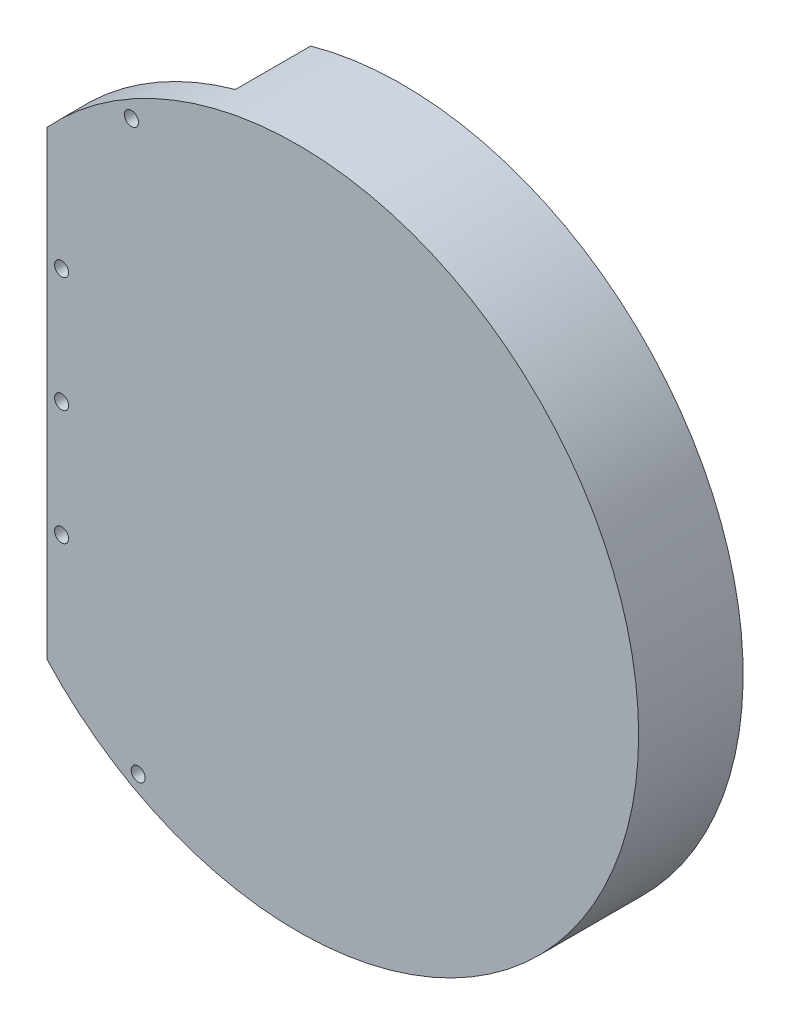
from build123d import *

# Parameters (mm, degrees)
BOSS_EXTRUDE1_DEPTH = 5
SKETCH2_R           = 1.2
CUT_EXTRUDE1_DEPTH  = 117.909745524
BOSS_EXTRUDE2_START = -17.879
BOSS_EXTRUDE2_DEPTH = 12.879


with BuildPart() as part:
    # Sketch1 → Boss-Extrude1 (new body)
    with BuildSketch(Plane.XY):
        with BuildLine():
            Line((0, -39.4175), (0, 39.4175))
            ThreePointArc((0, 39.4175), (101.221, 0), (0, -39.4175))
        make_face()
    extrude(amount=BOSS_EXTRUDE1_DEPTH)

    # Sketch2 → Cut-Extrude1 (cut, through all)
    with BuildSketch(Plane.XY.offset(5)):
        with Locations((2.5, 19.70875)):
            Circle(SKETCH2_R)
        with Locations((2.5, 0)):
            Circle(SKETCH2_R)
        with Locations((2.5, -19.70875)):
            Circle(SKETCH2_R)
        with Locations((14.450382973, 47.941684776)):
            Circle(SKETCH2_R)
        with Locations((15.603067001, -48.610455862)):
            Circle(SKETCH2_R)
    extrude(amount=-CUT_EXTRUDE1_DEPTH, mode=Mode.SUBTRACT)

    # Sketch3 → Boss-Extrude2 (add)
    with BuildSketch(Plane.XY.offset(5).offset(BOSS_EXTRUDE2_START)):
        with BuildLine():
            Line((27.955, -56.327452693), (27.955, -51.136357684))
            ThreePointArc((27.955, -51.136357684), (96.203818326, 1.353060418), (25.378179175, 50.30986847))
            Line((25.378179175, 50.30986847), (27.236614528, 56.131473172))
            ThreePointArc((27.236614528, 56.131473172), (101.219810829, 0.372318969), (27.955, -56.327452693))
        make_face()
    extrude(amount=BOSS_EXTRUDE2_DEPTH)


solid = part.part
